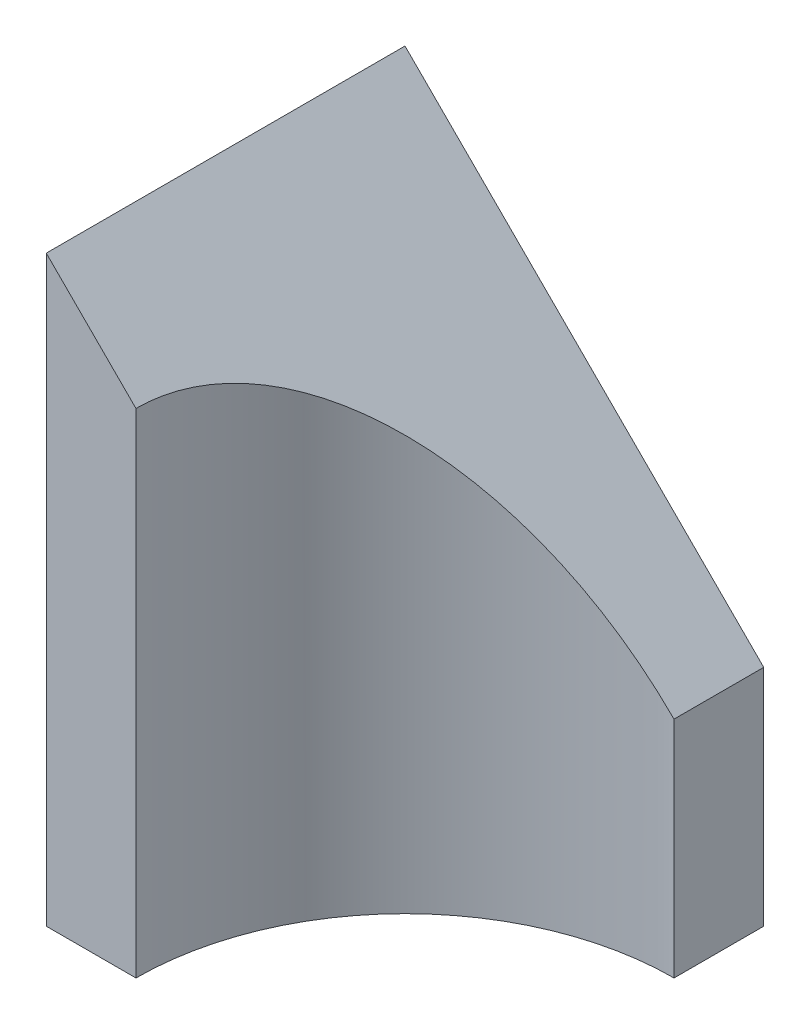
from build123d import *

# Parameters (mm, degrees)
BOSS_EXTRUDE1_DEPTH     = 82.55
CUT_EXTRUDE1_DEPTH      = 110.433918417
CUT_EXTRUDE1_DEPTH_BACK = 110.433918417


with BuildPart() as part:
    # Sketch1 → Boss-Extrude1 (new body)
    with BuildSketch(Plane(origin=(0, 0, 0), x_dir=(1, 0, 0), z_dir=(0, 1, 0))):
        with BuildLine():
            Line((0, 0), (0, -50.8))
            Line((0, -50.8), (12.7, -50.8))
            ThreePointArc((12.7, -50.8), (23.859231637, -23.859231637), (50.8, -12.7))
            Line((50.8, -12.7), (50.8, 0))
            Line((50.8, 0), (0, 0))
        make_face()
    extrude(amount=BOSS_EXTRUDE1_DEPTH)

    # Sketch2 → Cut-Extrude1 (cut, two sides: drawn at the far end of the back side and taken through both)
    with BuildSketch(Plane.XY.offset(-CUT_EXTRUDE1_DEPTH_BACK)):
        Polygon((-144.148728282, 226.698728282), (0, 82.55), (50.8, 31.75), (194.948728282, -112.398728282), (483.246184846, 175.898728282), (144.148728282, 514.996184846), align=None)
    extrude(amount=CUT_EXTRUDE1_DEPTH + CUT_EXTRUDE1_DEPTH_BACK, mode=Mode.SUBTRACT)


solid = part.part
